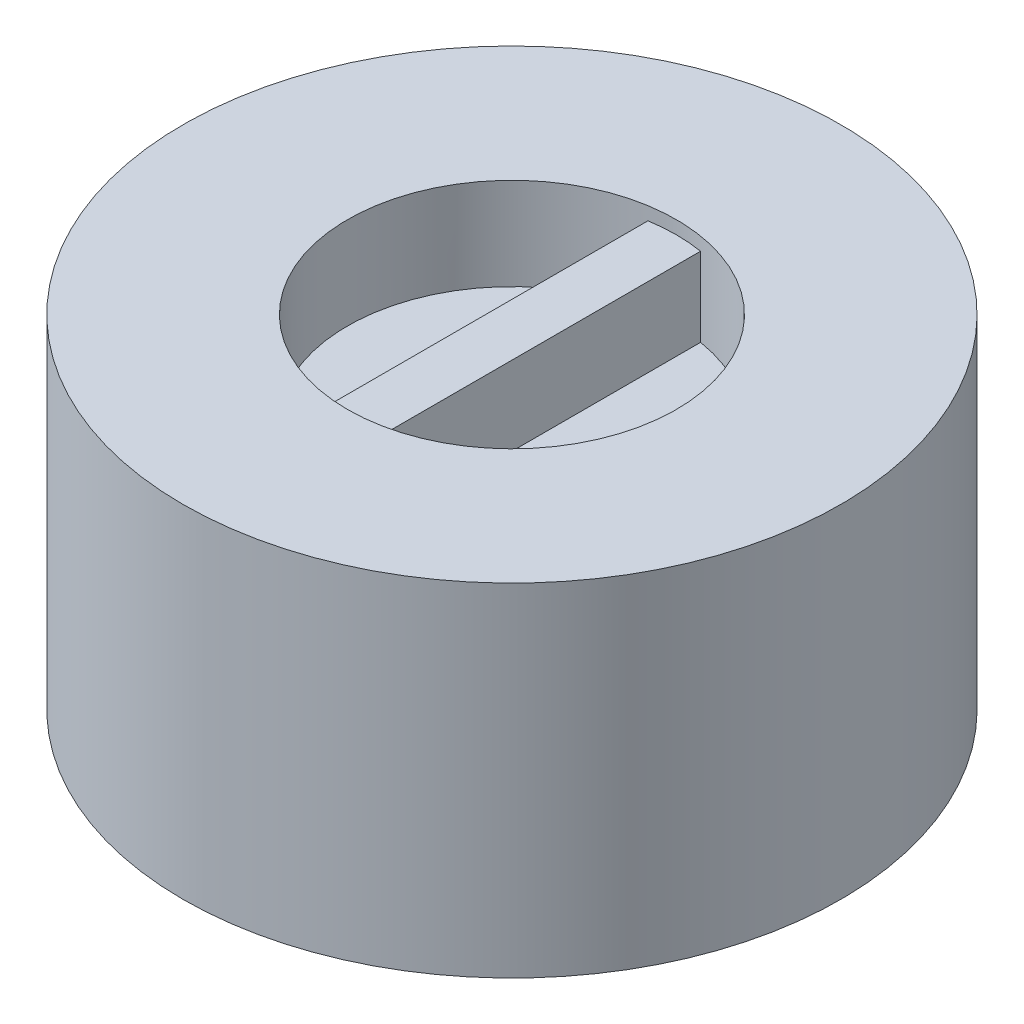
from build123d import *

# Parameters (mm, degrees)
SKETCH_1_R      = 2.5
EXTRUDE_1_DEPTH = 0.5
EXTRUDE_START   = -1.4
SKETCH_1_3_R    = 2.5
EXTRUDE_2_DEPTH = 1.4
SKETCH_2_W      = 0.4
SKETCH_2_H      = 2.5
EXTRUDE_3_DEPTH = 0.6
SKETCH_2_3_R    = 2.5
SKETCH_2_3_R_2  = 1.25
EXTRUDE_4_DEPTH = 0.7


with BuildPart() as part:
    # 草图1 → 凸台-拉伸1 (new body)
    with BuildSketch(Plane(origin=(0, 0, 0), x_dir=(1, 0, 0), z_dir=(0, 1, 0))):
        Circle(SKETCH_1_R)
    extrude(amount=EXTRUDE_1_DEPTH)

    # 草图1<3> → 凸台-拉伸2 (add)
    with BuildSketch(Plane(origin=(0, 0, 0), x_dir=(1, 0, 0), z_dir=(0, 1, 0)).offset(EXTRUDE_START)):
        Circle(SKETCH_1_3_R)
        with BuildLine():
            Line((1, 1.312440475), (1, -1.312440475))
            ThreePointArc((1, -1.312440475), (-1.65, 0), (1, 1.312440475))
        make_face(mode=Mode.SUBTRACT)
    extrude(amount=EXTRUDE_2_DEPTH)

    # 草图2 → 凸台-拉伸3 (add)
    with BuildSketch(Plane(origin=(0, 0.5, 0), x_dir=(1, 0, 0), z_dir=(0, 1, 0))):
        Rectangle(SKETCH_2_W, SKETCH_2_H)
    extrude(amount=EXTRUDE_3_DEPTH)

    # 草图2<3> → 凸台-拉伸4 (add)
    with BuildSketch(Plane(origin=(0, 0.5, 0), x_dir=(1, 0, 0), z_dir=(0, 1, 0))):
        Circle(SKETCH_2_3_R)
        Circle(SKETCH_2_3_R_2, mode=Mode.SUBTRACT)
    extrude(amount=EXTRUDE_4_DEPTH)


solid = part.part
